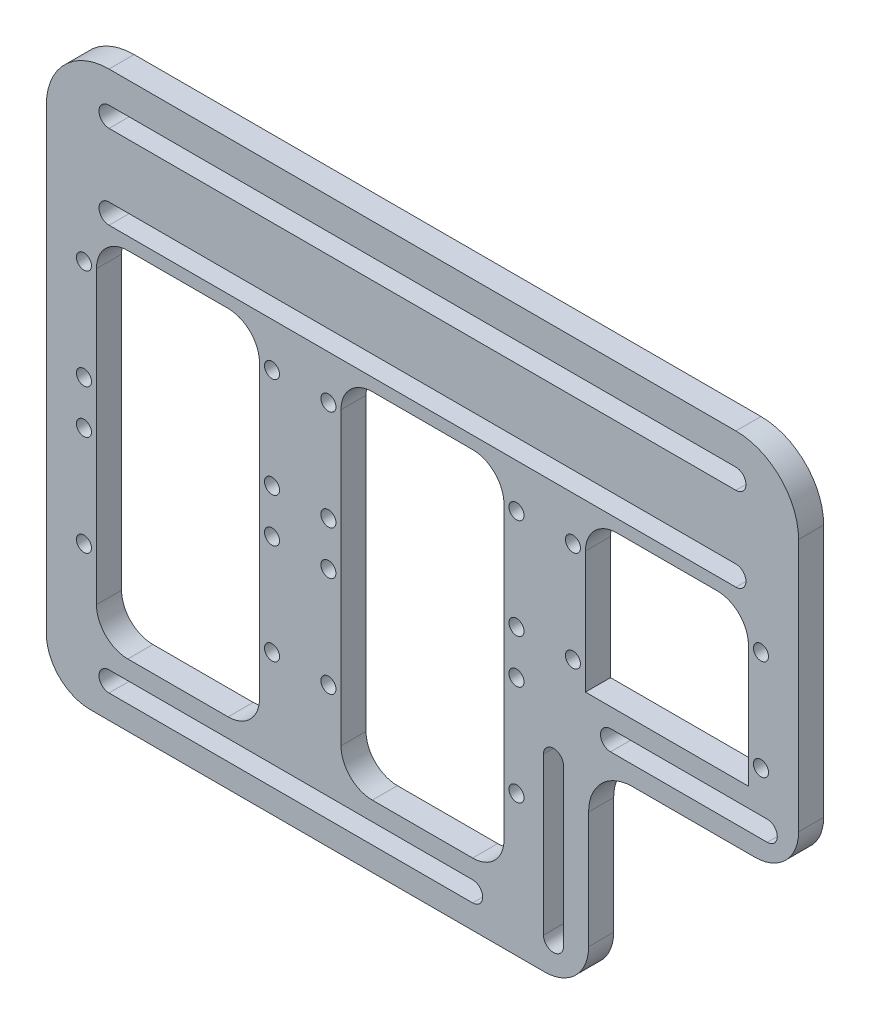
from build123d import *

# Parameters (mm, degrees)
SKETCH1_W            = 120
SKETCH1_H            = 90
PLATE_DEPTH          = 4
SLOT_CUT_DEPTH       = 76.106590923
SECOND_SLOT_COUNT    = 2
SECOND_SLOT_PITCH    = 13.38
MOTOR_OUTLINE_R      = 1.2
MOTOR_MOUNT_DEPTH    = 76.106590923
MOTORS_COUNT         = 3
MOTORS_PITCH         = 39
MOTORS_COUNT_DIR2    = 2
MOTORS_PITCH_DIR2    = 23
MOTOR_CUTOUT_DEPTH   = 76.106590923
CUTOUT_PATTERN_COUNT = 3
CUTOUT_PATTERN_PITCH = 39
FILLET1_R            = 10
SKETCH5_W            = 28
SKETCH5_H            = 2.3
BOSS_EXTRUDE1_DEPTH  = 4
SKETCH6_W            = 40.5
SKETCH6_H            = 39.62
CUT_EXTRUDE1_DEPTH   = 76.106590923
U2D2_MOUNT_DEPTH     = 76.106590923
BOSS_EXTRUDE2_DEPTH  = 4
THUMB_MOUNT_DEPTH    = 76.106590923
FILLET3_R            = 7


with BuildPart() as part:
    # Sketch1 → plate (new body)
    with BuildSketch(Plane.XY):
        Rectangle(SKETCH1_W, SKETCH1_H)
    extrude(amount=PLATE_DEPTH)

    # Sketch2 → slot_cut (cut, through all)
    with BuildSketch(Plane.XY.offset(4)):
        with BuildLine():
            Line((50, 36.8), (-50, 36.8))
            ThreePointArc((-50, 36.8), (-51.6, 38.4), (-50, 40))
            Line((-50, 40), (50, 40))
            ThreePointArc((50, 40), (51.6, 38.4), (50, 36.8))
        make_face()
    slot_cut = extrude(amount=-SLOT_CUT_DEPTH, mode=Mode.SUBTRACT)

    # second_slot: slot_cut ×2
    with Locations(*[(0, -i * SECOND_SLOT_PITCH, 0) for i in range(1, SECOND_SLOT_COUNT)]):
        add(slot_cut, mode=Mode.SUBTRACT)

    # motor_outline → motor_mount (cut, through all)
    with BuildSketch(Plane.XY.offset(4)):
        with Locations((-54, 16.42)):
            Circle(MOTOR_OUTLINE_R)
        with Locations(Location((-54, 0.42, 0), (0, 0, 180))):
            Circle(MOTOR_OUTLINE_R)
        with Locations((-24, 0.42)):
            Circle(MOTOR_OUTLINE_R)
        with Locations(Location((-24, 16.42, 0), (0, 0, 180))):
            Circle(MOTOR_OUTLINE_R)
    motor_mount = extrude(amount=-MOTOR_MOUNT_DEPTH, mode=Mode.SUBTRACT)

    # motors: motor_mount 3 × 2
    with Locations(*[(i * MOTORS_PITCH, -j * MOTORS_PITCH_DIR2, 0) for i in range(MOTORS_COUNT) for j in range(MOTORS_COUNT_DIR2) if (i, j) != (0, 0)]):
        add(motor_mount, mode=Mode.SUBTRACT)

    # motor_outline<5> → motor_cutout (cut, through all)
    with BuildSketch(Plane.XY.offset(4)):
        with BuildLine():
            Line((-26, -30), (-26, -1.58))
            Line((-26, -1.58), (-52, -1.58))
            Line((-52, -1.58), (-52, -30))
            ThreePointArc((-52, -30), (-50.535533906, -33.535533906), (-47, -35))
            Line((-47, -35), (-31, -35))
            ThreePointArc((-31, -35), (-27.464466094, -33.535533906), (-26, -30))
        make_face()
        with BuildLine():
            Line((-52, -1.58), (-26, -1.58))
            Line((-26, -1.58), (-26, 16.42))
            ThreePointArc((-26, 16.42), (-26.105468435, 17.441548218), (-26.417424305, 18.42))
            Line((-26.417424305, 18.42), (-51.582575695, 18.42))
            ThreePointArc((-51.582575695, 18.42), (-51.894531565, 17.441548218), (-52, 16.42))
            Line((-52, 16.42), (-52, -1.58))
        make_face()
        with BuildLine():
            Line((-51.582575695, 18.42), (-26.417424305, 18.42))
            ThreePointArc((-26.417424305, 18.42), (-28.261387212, 20.603300133), (-31, 21.42))
            Line((-31, 21.42), (-47, 21.42))
            ThreePointArc((-47, 21.42), (-49.738612788, 20.603300133), (-51.582575695, 18.42))
        make_face()
    motor_cutout = extrude(amount=-MOTOR_CUTOUT_DEPTH, mode=Mode.SUBTRACT)

    # cutout_pattern: motor_cutout ×3
    with Locations(*[(i * CUTOUT_PATTERN_PITCH, 0, 0) for i in range(1, CUTOUT_PATTERN_COUNT)]):
        add(motor_cutout, mode=Mode.SUBTRACT)

    # Fillet1
    fillet1_edges = [part.edges().sort_by_distance(p)[0] for p in [
        (-60, 45, 2),
        (60, 45, 2),
    ]]
    fillet(fillet1_edges, radius=FILLET1_R)

    # Sketch5 → Boss-Extrude1 (add)
    with BuildSketch(Plane.XY.offset(4)):
        with Locations((38, -4.23)):
            Rectangle(SKETCH5_W, SKETCH5_H)
    extrude(amount=-BOSS_EXTRUDE1_DEPTH)

    # Sketch6 → Cut-Extrude1 (cut, through all)
    with BuildSketch(Plane.XY.offset(4)):
        with Locations((39.75, -25.19)):
            Rectangle(SKETCH6_W, SKETCH6_H)
    extrude(amount=-CUT_EXTRUDE1_DEPTH, mode=Mode.SUBTRACT)

    # Sketch7 → U2D2_mount (cut, through all)
    with BuildSketch(Plane.XY.offset(4)):
        with BuildLine():
            Line((-50, -38), (8, -38))
            ThreePointArc((8, -38), (9.6, -39.6), (8, -41.2))
            Line((8, -41.2), (-50, -41.2))
            ThreePointArc((-50, -41.2), (-51.6, -39.6), (-50, -38))
        make_face()
    extrude(amount=-U2D2_MOUNT_DEPTH, mode=Mode.SUBTRACT)

    # Sketch8 → Boss-Extrude2 (add)
    with BuildSketch(Plane.XY.offset(4)):
        Polygon((19.5, -5.38), (60, -5.38), (60, -12.38), (26.5, -12.38), (26.5, -45), (19.5, -45), align=None)
    extrude(amount=-BOSS_EXTRUDE2_DEPTH)

    # Sketch9 → thumb_mount (cut, through all)
    with BuildSketch(Plane.XY.offset(4)):
        with BuildLine():
            Line((30, -6.13), (55, -6.13))
            ThreePointArc((55, -6.13), (56.6, -7.73), (55, -9.33))
            Line((55, -9.33), (30, -9.33))
            ThreePointArc((30, -9.33), (28.4, -7.73), (30, -6.13))
        make_face()
        with BuildLine():
            Line((22.5, -15), (22.5, -40))
            ThreePointArc((22.5, -40), (20.9, -41.6), (19.3, -40))
            Line((19.3, -40), (19.3, -15))
            ThreePointArc((19.3, -15), (20.9, -13.4), (22.5, -15))
        make_face()
    extrude(amount=-THUMB_MOUNT_DEPTH, mode=Mode.SUBTRACT)

    # Fillet3
    fillet3_edges = [part.edges().sort_by_distance(p)[0] for p in [
        (60, -12.38, 2),
        (26.5, -12.38, 2),
        (26.5, -45, 2),
        (-60, -45, 2),
    ]]
    fillet(fillet3_edges, radius=FILLET3_R)


solid = part.part
